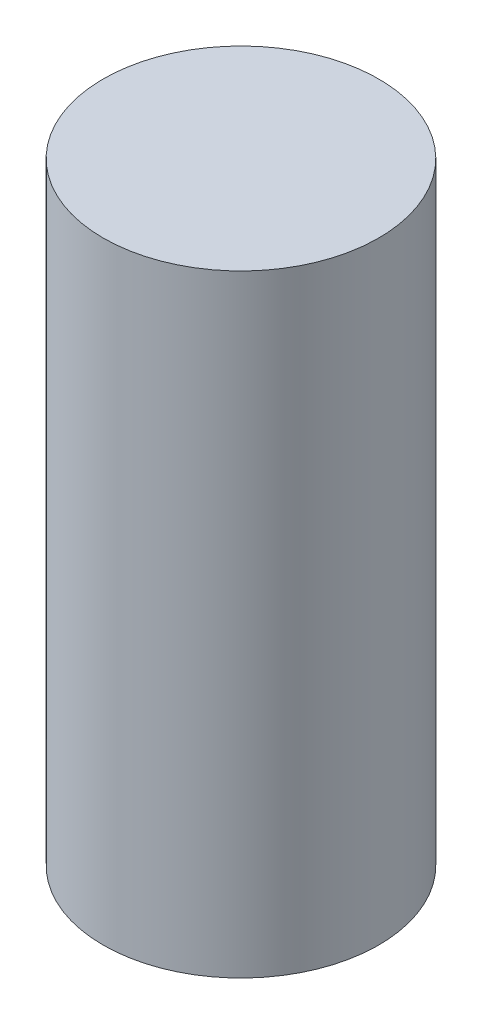
from build123d import *

# Parameters (mm, degrees)
SKETCH1_R           = 9
BOSS_EXTRUDE1_DEPTH = 40


with BuildPart() as part:
    # Sketch1 → Boss-Extrude1 (new body)
    with BuildSketch(Plane(origin=(0, 0, 0), x_dir=(1, 0, 0), z_dir=(0, 1, 0))):
        with Locations(Location((0, 0, 0), (0, 0, 270))):
            Circle(SKETCH1_R)
    extrude(amount=BOSS_EXTRUDE1_DEPTH)


solid = part.part
